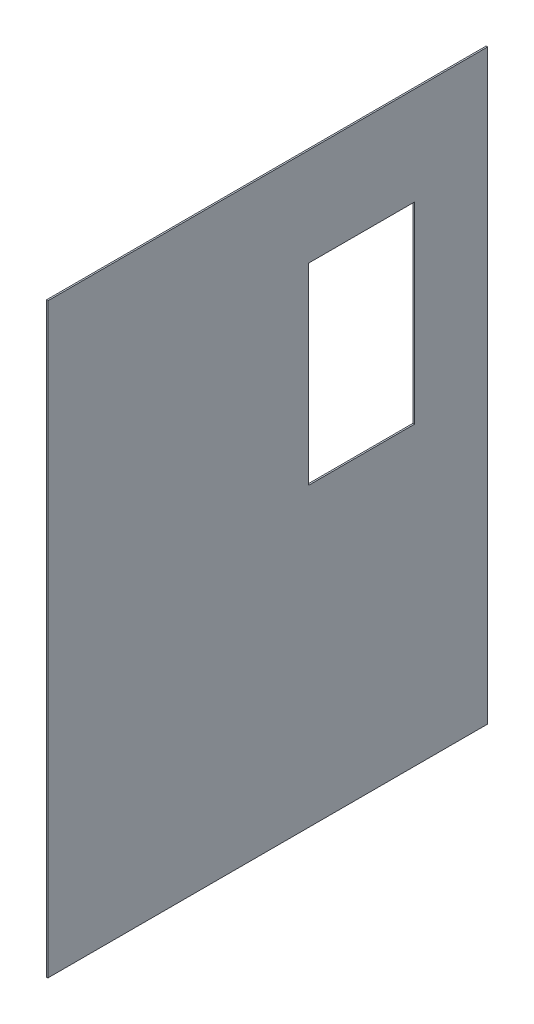
from build123d import *

# Parameters (mm, degrees)
SKETCH1_W            = 914.4
SKETCH1_H            = 1219.2
PLATE_BASE_DEPTH     = 1.5875
TANK_HOLE_DEPTH      = 763.001653644
TANK_HOLE_DEPTH_BACK = 763.001653644
SKETCH4_W            = 220
SKETCH4_H            = 400


with BuildPart() as part:
    # Sketch1 → Plate_Base (new, symmetric)
    with BuildSketch(Plane(origin=(0, 0, 0), x_dir=(0, 0, -1), z_dir=(1, 0, 0))):
        Rectangle(SKETCH1_W, SKETCH1_H)
    extrude(amount=PLATE_BASE_DEPTH, both=True)

    # Sketch4 → Tank_Hole (cut, two sides: drawn at the far end of the back side and taken through both)
    with BuildSketch(Plane(origin=(0, 0, 0), x_dir=(0, 0, -1), z_dir=(1, 0, 0)).offset(-TANK_HOLE_DEPTH_BACK)):
        with Locations((194.8, 206.4)):
            Rectangle(SKETCH4_W, SKETCH4_H)
    extrude(amount=TANK_HOLE_DEPTH + TANK_HOLE_DEPTH_BACK, mode=Mode.SUBTRACT)


solid = part.part
